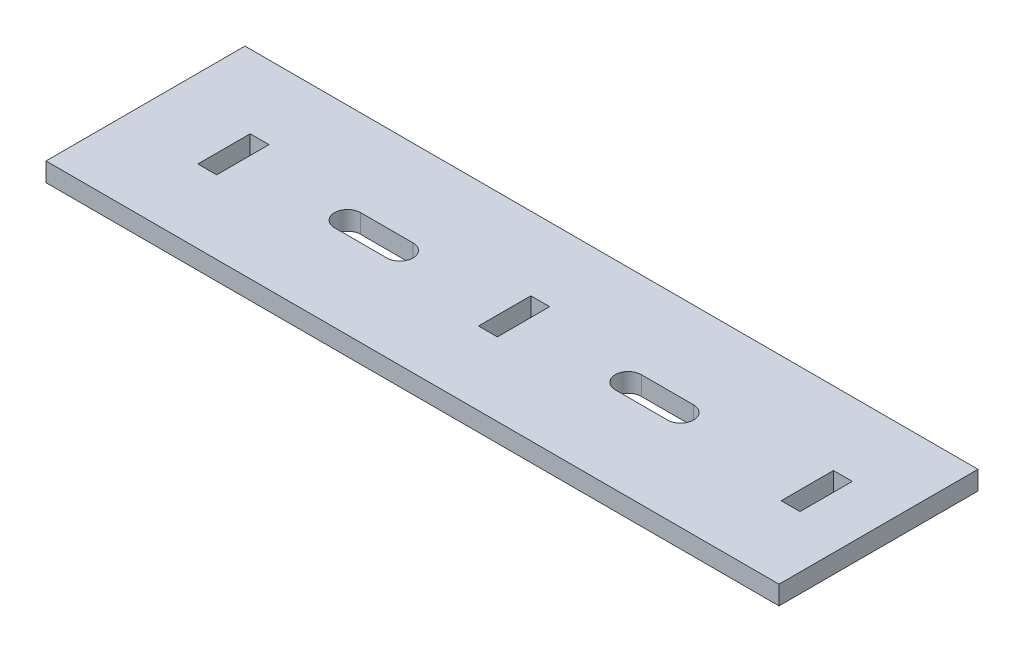
from build123d import *

# Parameters (mm, degrees)
SKETCH1_W           = 177.8
SKETCH1_H           = 48.26
SKETCH1_W_2         = 4.572
SKETCH1_H_2         = 12.7
BOSS_EXTRUDE1_DEPTH = 4.572
CUT_EXTRUDE1_DEPTH  = 5.08


with BuildPart() as part:
    # Sketch1 → Boss-Extrude1 (new body)
    with BuildSketch(Plane(origin=(0, 0, 0), x_dir=(1, 0, 0), z_dir=(0, 1, 0))):
        with Locations((88.9, 24.13)):
            Rectangle(SKETCH1_W, SKETCH1_H)
        with Locations((162.814, 24.13)):
            Rectangle(SKETCH1_W_2, SKETCH1_H_2, mode=Mode.SUBTRACT)
        with Locations((89.408, 24.13)):
            Rectangle(SKETCH1_W_2, SKETCH1_H_2, mode=Mode.SUBTRACT)
        with Locations((21.336, 24.13)):
            Rectangle(SKETCH1_W_2, SKETCH1_H_2, mode=Mode.SUBTRACT)
    extrude(amount=BOSS_EXTRUDE1_DEPTH)

    # Sketch2 → Cut-Extrude1 (cut)
    with BuildSketch(Plane(origin=(0, 4.572, 0), x_dir=(1, 0, 0), z_dir=(0, 1, 0))):
        with BuildLine():
            Line((49.022, 27.305), (61.722, 27.305))
            ThreePointArc((61.722, 27.305), (64.897, 24.13), (61.722, 20.955))
            Line((61.722, 20.955), (49.022, 20.955))
            ThreePointArc((49.022, 20.955), (45.847, 24.13), (49.022, 27.305))
        make_face()
        with BuildLine():
            Line((117.094, 27.305), (129.794, 27.305))
            ThreePointArc((129.794, 27.305), (132.969, 24.13), (129.794, 20.955))
            Line((129.794, 20.955), (117.094, 20.955))
            ThreePointArc((117.094, 20.955), (113.919, 24.13), (117.094, 27.305))
        make_face()
    extrude(amount=-CUT_EXTRUDE1_DEPTH, mode=Mode.SUBTRACT)


solid = part.part
